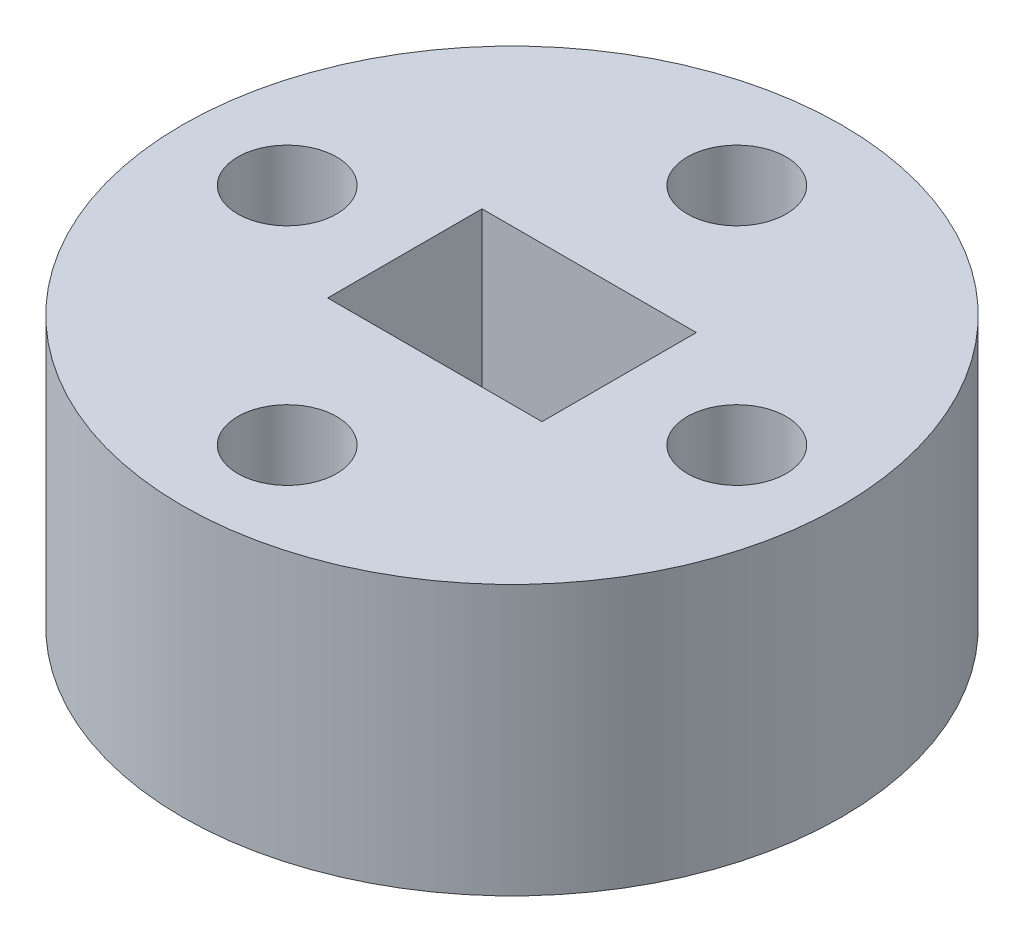
from build123d import *

# Parameters (mm, degrees)
SKETCH1_R                 = 22
SKETCH1_R_2               = 3.3
SKETCH1_W                 = 14.3
SKETCH1_H                 = 10.3
STEM_ADAPTER_FLANGE_DEPTH = 18


with BuildPart() as part:
    # Sketch1 → Stem_Adapter_Flange (new body)
    with BuildSketch(Plane(origin=(0, 0, 0), x_dir=(1, 0, 0), z_dir=(0, 1, 0))):
        with Locations(Location((0, 0, 0), (0, 0, 270))):
            Circle(SKETCH1_R)
        with Locations(Location((-15, 0, 0), (0, 0, 270))):
            Circle(SKETCH1_R_2, mode=Mode.SUBTRACT)
        with Locations(Location((15, 0, 0), (0, 0, 270))):
            Circle(SKETCH1_R_2, mode=Mode.SUBTRACT)
        with Locations(Location((0, -15, 0), (0, 0, 270))):
            Circle(SKETCH1_R_2, mode=Mode.SUBTRACT)
        with Locations(Location((0, 15, 0), (0, 0, 270))):
            Circle(SKETCH1_R_2, mode=Mode.SUBTRACT)
        Rectangle(SKETCH1_W, SKETCH1_H, mode=Mode.SUBTRACT)
    extrude(amount=STEM_ADAPTER_FLANGE_DEPTH)


solid = part.part
